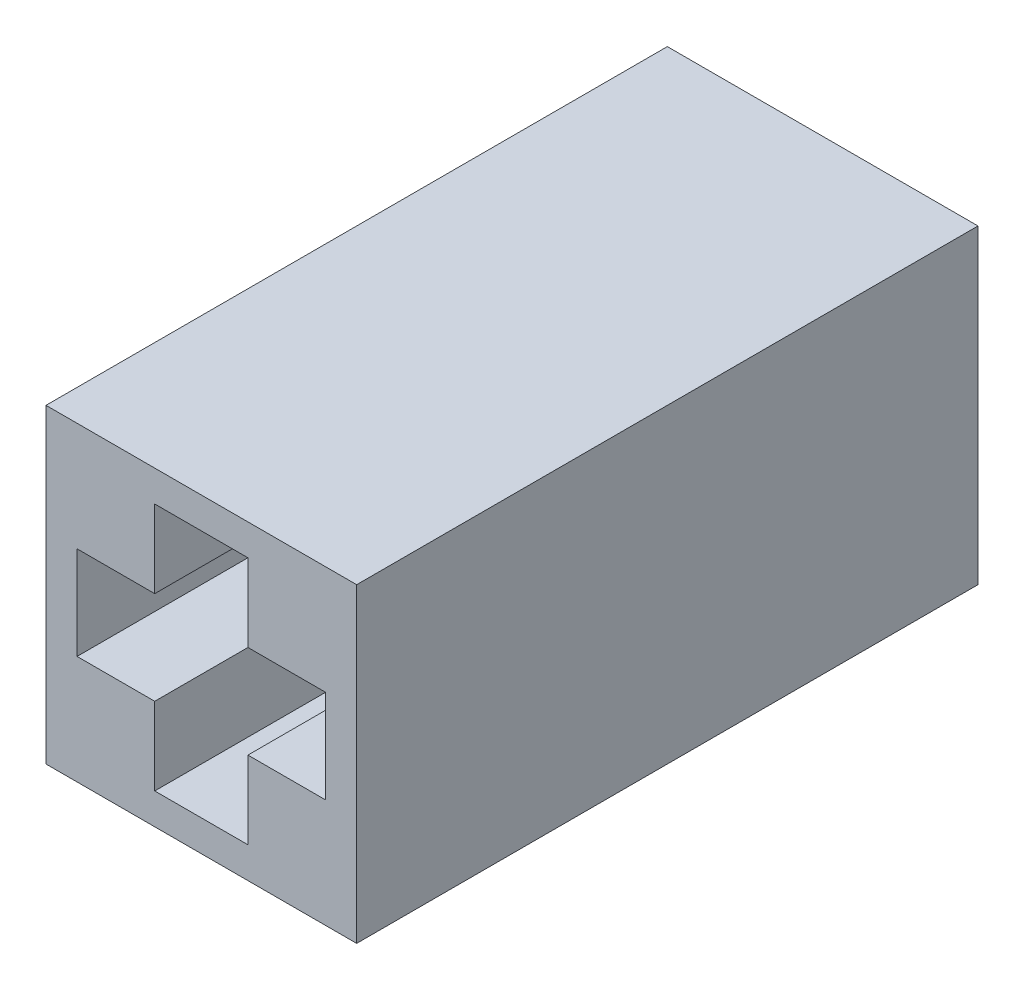
from build123d import *

# Parameters (mm, degrees)
SKETCH1_W           = 50
SKETCH1_H           = 50
BOSS_EXTRUDE1_DEPTH = 100
CUT_EXTRUDE1_DEPTH  = 400


with BuildPart() as part:
    # Sketch1 → Boss-Extrude1 (new body)
    with BuildSketch(Plane.XY):
        Rectangle(SKETCH1_W, SKETCH1_H)
    extrude(amount=-BOSS_EXTRUDE1_DEPTH)

    # Sketch2 → Cut-Extrude1 (cut)
    with BuildSketch(Plane.XY):
        Polygon((7.5, 7.5), (20, 7.5), (20, -7.5), (7.5, -7.5), (7.5, -20), (-7.5, -20), (-7.5, -7.5), (-20, -7.5), (-20, 7.5), (-7.5, 7.5), (-7.5, 20), (7.5, 20), align=None)
    extrude(amount=-CUT_EXTRUDE1_DEPTH, mode=Mode.SUBTRACT)


solid = part.part
